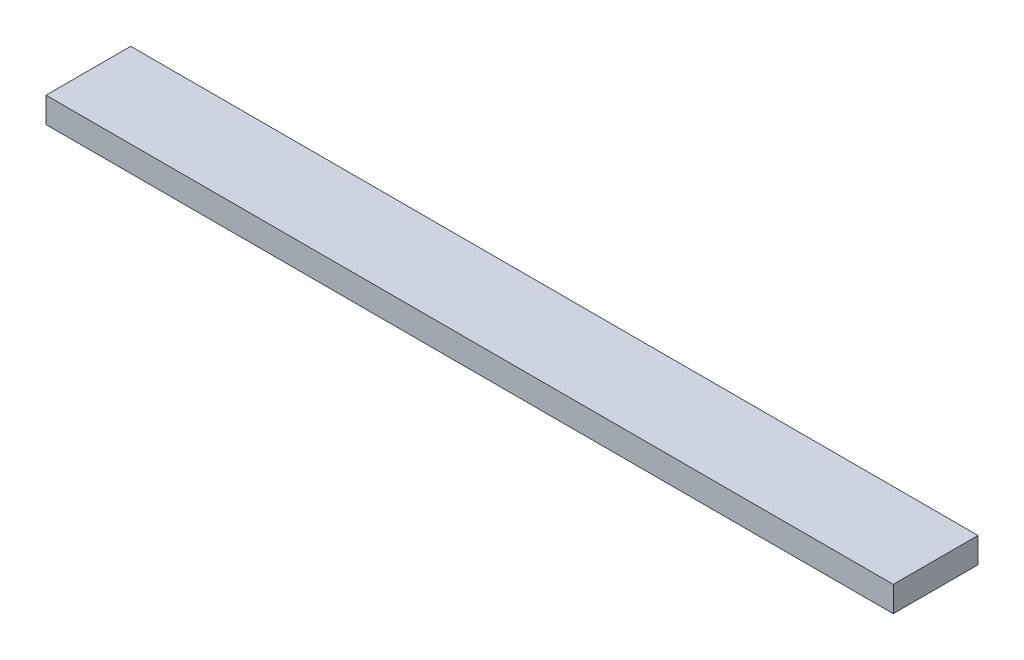
from build123d import *

# Parameters (mm, degrees)
SKETCH1_W           = 200
SKETCH1_H           = 20
BOSS_EXTRUDE1_DEPTH = 6


with BuildPart() as part:
    # Sketch1 → Boss-Extrude1 (new body)
    with BuildSketch(Plane(origin=(0, 0, 0), x_dir=(1, 0, 0), z_dir=(0, 1, 0))):
        with Locations((100, 10)):
            Rectangle(SKETCH1_W, SKETCH1_H)
    extrude(amount=BOSS_EXTRUDE1_DEPTH)


solid = part.part
